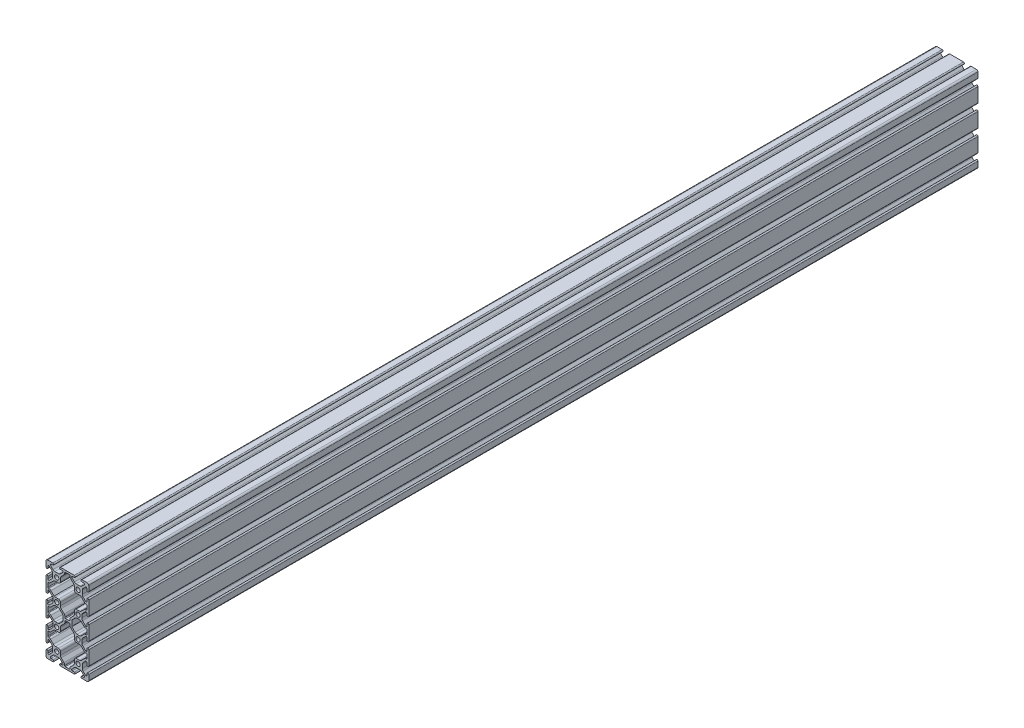
from build123d import *

# Parameters (mm, degrees)
SKETCH1_R      = 2.5
EXTRUDE1_DEPTH = 1039.898


with BuildPart() as part:
    # Sketch1 → Extrude1 (new body)
    with BuildSketch(Plane.XY):
        with BuildLine():
            Line((-8.202452575, 43.310755937), (-5.238252772, 46.27495574))
            ThreePointArc((-5.238252772, 46.27495574), (-5.03697983, 47.286823153), (-5.894799602, 47.86))
            Line((-5.894799602, 47.86), (-8.02436974, 47.86))
            ThreePointArc((-8.02436974, 47.86), (-9.09436974, 48.93), (-8.02436974, 50))
            Line((-8.02436974, 50), (-2.315834377, 50))
            Line((-2.315834377, 50), (2.315834377, 50))
            Line((2.315834377, 50), (8.02436974, 50))
            ThreePointArc((8.02436974, 50), (9.09436974, 48.93), (8.02436974, 47.86))
            Line((8.02436974, 47.86), (5.894799602, 47.86))
            ThreePointArc((5.894799602, 47.86), (5.03697983, 47.286823153), (5.238252772, 46.27495574))
            Line((5.238252772, 46.27495574), (8.202452575, 43.310755937))
            ThreePointArc((8.202452575, 43.310755937), (9.157595011, 42.672550862), (10.284262293, 42.448444577))
            Line((10.284262293, 42.448444577), (14.708234998, 42.448454152))
            ThreePointArc((14.708234998, 42.448454152), (15.83893827, 42.671117491), (16.797547425, 43.310755937))
            Line((16.797547425, 43.310755937), (19.761747228, 46.27495574))
            ThreePointArc((19.761747228, 46.27495574), (19.96302017, 47.286823153), (19.105200398, 47.86))
            Line((19.105200398, 47.86), (16.97563026, 47.86))
            ThreePointArc((16.97563026, 47.86), (15.90563026, 48.93), (16.97563026, 50))
            Line((16.97563026, 50), (21.758832238, 50))
            Line((21.758832238, 50), (23.041124805, 50))
            ThreePointArc((23.041124805, 50), (24.332005248, 49.521885571), (25, 48.318245783))
            Line((25, 48.318245783), (25, 42.082202669))
            ThreePointArc((25, 42.082202669), (23.93, 41.012202669), (22.86, 42.082202669))
            Line((22.86, 42.082202669), (22.86, 44.211772807))
            ThreePointArc((22.86, 44.211772807), (22.13773437, 44.916244594), (21.164272753, 44.651064241))
            Line((21.164272753, 44.651064241), (18.327918757, 41.814710246))
            ThreePointArc((18.327918757, 41.814710246), (17.639489034, 40.784402354), (17.397744663, 39.569071332))
            Line((17.397744663, 39.569071332), (17.397744663, 35.430928668))
            ThreePointArc((17.397744663, 35.430928668), (17.639489034, 34.215597646), (18.327918757, 33.185289754))
            Line((18.327918757, 33.185289754), (21.127116553, 30.386091959))
            ThreePointArc((21.127116553, 30.386091959), (22.233362186, 30.166046021), (22.86, 31.103875784))
            Line((22.86, 31.103875784), (22.86, 33.442202669))
            ThreePointArc((22.86, 33.442202669), (23.93, 34.512202669), (25, 33.442202669))
            Line((25, 33.442202669), (25, 29.299008941))
            Line((25, 29.299008941), (25, 21.219740648))
            Line((25, 21.219740648), (25, 17.040370729))
            ThreePointArc((25, 17.040370729), (23.904333588, 15.955956055), (22.86646371, 17.095809637))
            Line((22.86646371, 17.095809637), (22.86646371, 19.489411218))
            ThreePointArc((22.86646371, 19.489411218), (22.119482528, 20.02126145), (21.24830289, 19.735094378))
            Line((21.24830289, 19.735094378), (17.927013012, 16.4138045))
            ThreePointArc((17.927013012, 16.4138045), (17.222742213, 15.542217138), (16.865021315, 14.480286045))
            Line((16.865021315, 14.480286045), (16.865021315, 11.373754622))
            ThreePointArc((16.865021315, 11.373754622), (17.006264756, 9.974657926), (17.737790465, 8.77370355))
            Line((17.737790465, 8.77370355), (21.060805533, 5.450688482))
            ThreePointArc((21.060805533, 5.450688482), (22.48261952, 5.067456017), (22.865851985, 6.489270005))
            Line((22.865851985, 6.489270005), (22.865851985, 8.266111582))
            ThreePointArc((22.865851985, 8.266111582), (23.927171289, 9.338940293), (25, 8.277620989))
            Line((25, 8.277620989), (25, 3.7699517))
            Line((25, 3.7699517), (25, -3.7699517))
            Line((25, -3.7699517), (25, -8.277620989))
            ThreePointArc((25, -8.277620989), (23.927171289, -9.338940293), (22.865851985, -8.266111582))
            Line((22.865851985, -8.266111582), (22.865851985, -6.489270005))
            ThreePointArc((22.865851985, -6.489270005), (22.48261952, -5.067456017), (21.060805533, -5.450688482))
            Line((21.060805533, -5.450688482), (17.737790465, -8.77370355))
            ThreePointArc((17.737790465, -8.77370355), (17.006264756, -9.974657926), (16.865021315, -11.373754622))
            Line((16.865021315, -11.373754622), (16.865021315, -14.480286045))
            ThreePointArc((16.865021315, -14.480286045), (17.222742213, -15.542217138), (17.927013012, -16.4138045))
            Line((17.927013012, -16.4138045), (21.24830289, -19.735094378))
            ThreePointArc((21.24830289, -19.735094378), (22.119482528, -20.02126145), (22.86646371, -19.489411218))
            Line((22.86646371, -19.489411218), (22.86646371, -17.095809637))
            ThreePointArc((22.86646371, -17.095809637), (23.904333588, -15.955956055), (25, -17.040370729))
            Line((25, -17.040370729), (25, -21.219740648))
            Line((25, -21.219740648), (25, -29.299008941))
            Line((25, -29.299008941), (25, -33.442202669))
            ThreePointArc((25, -33.442202669), (23.93, -34.512202669), (22.86, -33.442202669))
            Line((22.86, -33.442202669), (22.86, -31.103875784))
            ThreePointArc((22.86, -31.103875784), (22.233362186, -30.166046021), (21.127116553, -30.386091959))
            Line((21.127116553, -30.386091959), (18.327918757, -33.185289754))
            ThreePointArc((18.327918757, -33.185289754), (17.639489034, -34.215597646), (17.397744663, -35.430928668))
            Line((17.397744663, -35.430928668), (17.397744663, -39.569071332))
            ThreePointArc((17.397744663, -39.569071332), (17.639489034, -40.784402354), (18.327918757, -41.814710246))
            Line((18.327918757, -41.814710246), (21.164272753, -44.651064241))
            ThreePointArc((21.164272753, -44.651064241), (22.13773437, -44.916244594), (22.86, -44.211772807))
            Line((22.86, -44.211772807), (22.86, -42.082202669))
            ThreePointArc((22.86, -42.082202669), (23.93, -41.012202669), (25, -42.082202669))
            Line((25, -42.082202669), (25, -48.318245783))
            ThreePointArc((25, -48.318245783), (24.332005248, -49.521885571), (23.041124805, -50))
            Line((23.041124805, -50), (21.758832238, -50))
            Line((21.758832238, -50), (16.97563026, -50))
            ThreePointArc((16.97563026, -50), (15.90563026, -48.93), (16.97563026, -47.86))
            Line((16.97563026, -47.86), (19.105200398, -47.86))
            ThreePointArc((19.105200398, -47.86), (19.96302017, -47.286823153), (19.761747228, -46.27495574))
            Line((19.761747228, -46.27495574), (16.797547425, -43.310755937))
            ThreePointArc((16.797547425, -43.310755937), (15.83893827, -42.671117491), (14.708234998, -42.448454152))
            Line((14.708234998, -42.448454152), (10.284262293, -42.448444577))
            ThreePointArc((10.284262293, -42.448444577), (9.157595011, -42.672550862), (8.202452575, -43.310755937))
            Line((8.202452575, -43.310755937), (5.238252772, -46.27495574))
            ThreePointArc((5.238252772, -46.27495574), (5.03697983, -47.286823153), (5.894799602, -47.86))
            Line((5.894799602, -47.86), (8.02436974, -47.86))
            ThreePointArc((8.02436974, -47.86), (9.09436974, -48.93), (8.02436974, -50))
            Line((8.02436974, -50), (2.315834377, -50))
            Line((2.315834377, -50), (-2.315834377, -50))
            Line((-2.315834377, -50), (-8.02436974, -50))
            ThreePointArc((-8.02436974, -50), (-9.09436974, -48.93), (-8.02436974, -47.86))
            Line((-8.02436974, -47.86), (-5.894799602, -47.86))
            ThreePointArc((-5.894799602, -47.86), (-5.03697983, -47.286823153), (-5.238252772, -46.27495574))
            Line((-5.238252772, -46.27495574), (-8.202452575, -43.310755937))
            ThreePointArc((-8.202452575, -43.310755937), (-9.157595011, -42.672550862), (-10.284262293, -42.448444577))
            Line((-10.284262293, -42.448444577), (-14.708234998, -42.448454152))
            ThreePointArc((-14.708234998, -42.448454152), (-15.83893827, -42.671117491), (-16.797547425, -43.310755937))
            Line((-16.797547425, -43.310755937), (-19.761747228, -46.27495574))
            ThreePointArc((-19.761747228, -46.27495574), (-19.96302017, -47.286823153), (-19.105200398, -47.86))
            Line((-19.105200398, -47.86), (-16.97563026, -47.86))
            ThreePointArc((-16.97563026, -47.86), (-15.90563026, -48.93), (-16.97563026, -50))
            Line((-16.97563026, -50), (-23.041124805, -50))
            ThreePointArc((-23.041124805, -50), (-24.332005248, -49.521885571), (-25, -48.318245783))
            Line((-25, -48.318245783), (-25, -42.082202669))
            ThreePointArc((-25, -42.082202669), (-23.93, -41.012202669), (-22.86, -42.082202669))
            Line((-22.86, -42.082202669), (-22.86, -44.211772807))
            ThreePointArc((-22.86, -44.211772807), (-22.13773437, -44.916244594), (-21.164272753, -44.651064241))
            Line((-21.164272753, -44.651064241), (-18.327918757, -41.814710246))
            ThreePointArc((-18.327918757, -41.814710246), (-17.639489034, -40.784402354), (-17.397744663, -39.569071332))
            Line((-17.397744663, -39.569071332), (-17.397744663, -35.430928668))
            ThreePointArc((-17.397744663, -35.430928668), (-17.639489034, -34.215597646), (-18.327918757, -33.185289754))
            Line((-18.327918757, -33.185289754), (-21.127116553, -30.386091959))
            ThreePointArc((-21.127116553, -30.386091959), (-22.233362186, -30.166046021), (-22.86, -31.103875784))
            Line((-22.86, -31.103875784), (-22.86, -33.442202669))
            ThreePointArc((-22.86, -33.442202669), (-23.93, -34.512202669), (-25, -33.442202669))
            Line((-25, -33.442202669), (-25, -29.299008941))
            Line((-25, -29.299008941), (-25, -21.219740648))
            Line((-25, -21.219740648), (-25, -17.040370729))
            ThreePointArc((-25, -17.040370729), (-23.904333588, -15.955956055), (-22.86646371, -17.095809637))
            Line((-22.86646371, -17.095809637), (-22.86646371, -19.489411218))
            ThreePointArc((-22.86646371, -19.489411218), (-22.119482528, -20.02126145), (-21.24830289, -19.735094378))
            Line((-21.24830289, -19.735094378), (-17.927013012, -16.4138045))
            ThreePointArc((-17.927013012, -16.4138045), (-17.222742213, -15.542217138), (-16.865021315, -14.480286045))
            Line((-16.865021315, -14.480286045), (-16.865021315, -11.373754622))
            ThreePointArc((-16.865021315, -11.373754622), (-17.006264756, -9.974657926), (-17.737790465, -8.77370355))
            Line((-17.737790465, -8.77370355), (-21.060805533, -5.450688482))
            ThreePointArc((-21.060805533, -5.450688482), (-22.48261952, -5.067456017), (-22.865851985, -6.489270005))
            Line((-22.865851985, -6.489270005), (-22.865851985, -8.266111582))
            ThreePointArc((-22.865851985, -8.266111582), (-23.927171289, -9.338940293), (-25, -8.277620989))
            Line((-25, -8.277620989), (-25, -3.7699517))
            Line((-25, -3.7699517), (-25, 3.7699517))
            Line((-25, 3.7699517), (-25, 8.277620989))
            ThreePointArc((-25, 8.277620989), (-23.927171289, 9.338940293), (-22.865851985, 8.266111582))
            Line((-22.865851985, 8.266111582), (-22.865851985, 6.489270005))
            ThreePointArc((-22.865851985, 6.489270005), (-22.48261952, 5.067456017), (-21.060805533, 5.450688482))
            Line((-21.060805533, 5.450688482), (-17.737790465, 8.77370355))
            ThreePointArc((-17.737790465, 8.77370355), (-17.006264756, 9.974657926), (-16.865021315, 11.373754622))
            Line((-16.865021315, 11.373754622), (-16.865021315, 14.480286045))
            ThreePointArc((-16.865021315, 14.480286045), (-17.222742213, 15.542217138), (-17.927013012, 16.4138045))
            Line((-17.927013012, 16.4138045), (-21.24830289, 19.735094378))
            ThreePointArc((-21.24830289, 19.735094378), (-22.119482528, 20.02126145), (-22.86646371, 19.489411218))
            Line((-22.86646371, 19.489411218), (-22.86646371, 17.095809637))
            ThreePointArc((-22.86646371, 17.095809637), (-23.904333588, 15.955956055), (-25, 17.040370729))
            Line((-25, 17.040370729), (-25, 21.219740648))
            Line((-25, 21.219740648), (-25, 29.299008941))
            Line((-25, 29.299008941), (-25, 33.442202669))
            ThreePointArc((-25, 33.442202669), (-23.93, 34.512202669), (-22.86, 33.442202669))
            Line((-22.86, 33.442202669), (-22.86, 31.103875784))
            ThreePointArc((-22.86, 31.103875784), (-22.233362186, 30.166046021), (-21.127116553, 30.386091959))
            Line((-21.127116553, 30.386091959), (-18.327918757, 33.185289754))
            ThreePointArc((-18.327918757, 33.185289754), (-17.639489034, 34.215597646), (-17.397744663, 35.430928668))
            Line((-17.397744663, 35.430928668), (-17.397744663, 39.569071332))
            ThreePointArc((-17.397744663, 39.569071332), (-17.639489034, 40.784402354), (-18.327918757, 41.814710246))
            Line((-18.327918757, 41.814710246), (-21.164272753, 44.651064241))
            ThreePointArc((-21.164272753, 44.651064241), (-22.13773437, 44.916244594), (-22.86, 44.211772807))
            Line((-22.86, 44.211772807), (-22.86, 42.082202669))
            ThreePointArc((-22.86, 42.082202669), (-23.93, 41.012202669), (-25, 42.082202669))
            Line((-25, 42.082202669), (-25, 48.318245783))
            ThreePointArc((-25, 48.318245783), (-24.332005248, 49.521885571), (-23.041124805, 50))
            Line((-23.041124805, 50), (-16.97563026, 50))
            ThreePointArc((-16.97563026, 50), (-15.90563026, 48.93), (-16.97563026, 47.86))
            Line((-16.97563026, 47.86), (-19.105200398, 47.86))
            ThreePointArc((-19.105200398, 47.86), (-19.96302017, 47.286823153), (-19.761747228, 46.27495574))
            Line((-19.761747228, 46.27495574), (-16.797547425, 43.310755937))
            ThreePointArc((-16.797547425, 43.310755937), (-15.83893827, 42.671117491), (-14.708234998, 42.448454152))
            Line((-14.708234998, 42.448454152), (-10.284262293, 42.448444577))
            ThreePointArc((-10.284262293, 42.448444577), (-9.157595011, 42.672550862), (-8.202452575, 43.310755937))
        make_face()
        with Locations((-12.5, 12.5)):
            Circle(SKETCH1_R, mode=Mode.SUBTRACT)
        with Locations((-12.5, 37.5)):
            Circle(SKETCH1_R, mode=Mode.SUBTRACT)
        with Locations((12.5, -12.5)):
            Circle(SKETCH1_R, mode=Mode.SUBTRACT)
        with Locations((12.5, -37.5)):
            Circle(SKETCH1_R, mode=Mode.SUBTRACT)
        with Locations(Location((-12.5, -37.5, 0), (0, 0, 180))):
            Circle(SKETCH1_R, mode=Mode.SUBTRACT)
        with Locations(Location((-12.5, -12.5, 0), (0, 0, 180))):
            Circle(SKETCH1_R, mode=Mode.SUBTRACT)
        with Locations(Location((12.5, 37.5, 0), (0, 0, 180))):
            Circle(SKETCH1_R, mode=Mode.SUBTRACT)
        with Locations(Location((12.5, 12.5, 0), (0, 0, 180))):
            Circle(SKETCH1_R, mode=Mode.SUBTRACT)
        with BuildLine():
            Line((-8.185773444, 12.487513796), (-8.185773444, 11.011393555))
            ThreePointArc((-8.185773444, 11.011393555), (-8.008609194, 9.643792267), (-7.268461542, 8.480219361))
            Line((-7.268461542, 8.480219361), (-3.754938975, 4.966696794))
            ThreePointArc((-3.754938975, 4.966696794), (-3.063534403, 3.923946022), (-2.832523582, 2.694310526))
            Line((-2.832523582, 2.694310526), (-2.832523582, 1.819708918))
            ThreePointArc((-2.832523582, 1.819708918), (-2.609281799, 1.280755579), (-2.07032846, 1.057513796))
            Line((-2.07032846, 1.057513796), (2.072320044, 1.057513796))
            ThreePointArc((2.072320044, 1.057513796), (2.611273383, 1.280755579), (2.834515166, 1.819708918))
            Line((2.834515166, 1.819708918), (2.834515166, 2.694310526))
            ThreePointArc((2.834515166, 2.694310526), (3.065525987, 3.923946022), (3.756930558, 4.966696794))
            Line((3.756930558, 4.966696794), (7.270453125, 8.480219361))
            ThreePointArc((7.270453125, 8.480219361), (8.010600778, 9.643792267), (8.187765028, 11.011393555))
            Line((8.187765028, 11.011393555), (8.187765028, 14.589100627))
            ThreePointArc((8.187765028, 14.589100627), (8.835059042, 16.151806613), (10.397765028, 16.799100627))
            Line((10.397765028, 16.799100627), (14.322526745, 16.799100627))
            ThreePointArc((14.322526745, 16.799100627), (14.978333775, 16.883638222), (15.602419985, 17.102146501))
            Line((15.602419985, 17.102146501), (19.298207918, 20.797934434))
            ThreePointArc((19.298207918, 20.797934434), (20.326629934, 21.485104056), (21.539736414, 21.726405938))
            Line((21.539736414, 21.726405938), (22.112655364, 21.726405938))
            ThreePointArc((22.112655364, 21.726405938), (22.651608703, 21.94964772), (22.874850486, 22.488601059))
            Line((22.874850486, 22.488601059), (22.874850486, 26.856767325))
            ThreePointArc((22.874850486, 26.856767325), (22.653840578, 27.386829201), (22.125606626, 27.612173081))
            Line((22.125606626, 27.612173081), (21.871541586, 27.612173081))
            ThreePointArc((21.871541586, 27.612173081), (20.717547023, 27.958593442), (19.776177785, 28.710613704))
            Line((19.776177785, 28.710613704), (16.387363346, 32.099428142))
            ThreePointArc((16.387363346, 32.099428142), (15.195987364, 32.790442646), (13.839798728, 33.030505467))
            Line((13.839798728, 33.030505467), (10.362350257, 33.030505467))
            ThreePointArc((10.362350257, 33.030505467), (8.799644271, 33.67779948), (8.152350257, 35.240505467))
            Line((8.152350257, 35.240505467), (8.152350257, 39.051208905))
            ThreePointArc((8.152350257, 39.051208905), (7.904533851, 40.249092372), (7.222341418, 41.26445007))
            Line((7.222341418, 41.26445007), (4.012209831, 44.474581658))
            ThreePointArc((4.012209831, 44.474581658), (3.329287545, 45.496647086), (3.089477129, 46.70225546))
            Line((3.089477129, 46.70225546), (3.089477129, 47.097840517))
            ThreePointArc((3.089477129, 47.097840517), (2.866245785, 47.636768656), (2.327317646, 47.86))
            Line((2.327317646, 47.86), (0, 47.86))
            Line((0, 47.86), (-2.327317646, 47.86))
            ThreePointArc((-2.327317646, 47.86), (-2.866245785, 47.636768656), (-3.089477129, 47.097840517))
            Line((-3.089477129, 47.097840517), (-3.089477129, 46.70225546))
            ThreePointArc((-3.089477129, 46.70225546), (-3.329287545, 45.496647086), (-4.012209831, 44.474581658))
            Line((-4.012209831, 44.474581658), (-7.222341418, 41.26445007))
            ThreePointArc((-7.222341418, 41.26445007), (-7.904533851, 40.249092372), (-8.152350257, 39.051208905))
            Line((-8.152350257, 39.051208905), (-8.152350257, 35.240505467))
            ThreePointArc((-8.152350257, 35.240505467), (-8.799644271, 33.67779948), (-10.362350257, 33.030505467))
            Line((-10.362350257, 33.030505467), (-10.389864765, 33.030505467))
            Line((-10.389864765, 33.030505467), (-13.839798728, 33.030505467))
            ThreePointArc((-13.839798728, 33.030505467), (-15.195987364, 32.790442646), (-16.387363346, 32.099428142))
            Line((-16.387363346, 32.099428142), (-19.776177785, 28.710613704))
            ThreePointArc((-19.776177785, 28.710613704), (-20.711520847, 27.964936369), (-21.856598739, 27.618962447))
            Line((-21.856598739, 27.618962447), (-22.11066378, 27.618962447))
            ThreePointArc((-22.11066378, 27.618962447), (-22.649617119, 27.395720665), (-22.872858902, 26.856767325))
            Line((-22.872858902, 26.856767325), (-22.872858902, 22.488601059))
            ThreePointArc((-22.872858902, 22.488601059), (-22.649617119, 21.94964772), (-22.11066378, 21.726405938))
            Line((-22.11066378, 21.726405938), (-21.537744831, 21.726405938))
            ThreePointArc((-21.537744831, 21.726405938), (-20.32463835, 21.485104056), (-19.296216334, 20.797934434))
            Line((-19.296216334, 20.797934434), (-15.600428402, 17.102146501))
            ThreePointArc((-15.600428402, 17.102146501), (-14.976342192, 16.883638222), (-14.320535162, 16.799100627))
            Line((-14.320535162, 16.799100627), (-10.395773444, 16.799100627))
            ThreePointArc((-10.395773444, 16.799100627), (-8.833067458, 16.151806613), (-8.185773444, 14.589100627))
            Line((-8.185773444, 14.589100627), (-8.185773444, 12.487513796))
        make_face(mode=Mode.SUBTRACT)
        with BuildLine():
            Line((-22.86, 2.484036233), (-22.86, -2.484036233))
            ThreePointArc((-22.86, -2.484036233), (-22.636758217, -3.022989573), (-22.097804878, -3.246231355))
            Line((-22.097804878, -3.246231355), (-21.843739837, -3.246231355))
            ThreePointArc((-21.843739837, -3.246231355), (-20.485171192, -3.421032102), (-19.329200619, -4.155876372))
            Line((-19.329200619, -4.155876372), (-16.293050967, -7.192026025))
            ThreePointArc((-16.293050967, -7.192026025), (-15.262743076, -7.880455748), (-14.047412053, -8.122200119))
            Line((-14.047412053, -8.122200119), (-11.24083373, -8.122200119))
            ThreePointArc((-11.24083373, -8.122200119), (-10.025502708, -7.880455748), (-8.995194816, -7.192026025))
            Line((-8.995194816, -7.192026025), (-5.327964206, -3.524795414))
            ThreePointArc((-5.327964206, -3.524795414), (-5.186657366, -3.313314782), (-5.137037002, -3.063856368))
            Line((-5.137037002, -3.063856368), (-5.137037002, 3.063856368))
            ThreePointArc((-5.137037002, 3.063856368), (-5.186657366, 3.313314782), (-5.327964206, 3.524795414))
            Line((-5.327964206, 3.524795414), (-8.995194816, 7.192026025))
            ThreePointArc((-8.995194816, 7.192026025), (-10.025502708, 7.880455748), (-11.24083373, 8.122200119))
            Line((-11.24083373, 8.122200119), (-14.047412053, 8.122200119))
            ThreePointArc((-14.047412053, 8.122200119), (-15.262743076, 7.880455748), (-16.293050967, 7.192026025))
            Line((-16.293050967, 7.192026025), (-19.329200619, 4.155876372))
            ThreePointArc((-19.329200619, 4.155876372), (-20.485171192, 3.421032102), (-21.843739837, 3.246231355))
            Line((-21.843739837, 3.246231355), (-22.097804878, 3.246231355))
            ThreePointArc((-22.097804878, 3.246231355), (-22.636758217, 3.022989573), (-22.86, 2.484036233))
        make_face(mode=Mode.SUBTRACT)
        with BuildLine():
            Line((5.137037002, 3.063856368), (5.137037002, -3.063856368))
            ThreePointArc((5.137037002, -3.063856368), (5.186657366, -3.313314782), (5.327964206, -3.524795414))
            Line((5.327964206, -3.524795414), (8.995194816, -7.192026025))
            ThreePointArc((8.995194816, -7.192026025), (10.025502708, -7.880455748), (11.24083373, -8.122200119))
            Line((11.24083373, -8.122200119), (14.047412053, -8.122200119))
            ThreePointArc((14.047412053, -8.122200119), (15.262743076, -7.880455748), (16.293050967, -7.192026025))
            Line((16.293050967, -7.192026025), (19.329200619, -4.155876372))
            ThreePointArc((19.329200619, -4.155876372), (20.485171192, -3.421032102), (21.843739837, -3.246231355))
            Line((21.843739837, -3.246231355), (22.097804878, -3.246231355))
            ThreePointArc((22.097804878, -3.246231355), (22.636758217, -3.022989573), (22.86, -2.484036233))
            Line((22.86, -2.484036233), (22.86, 2.484036233))
            ThreePointArc((22.86, 2.484036233), (22.636758217, 3.022989573), (22.097804878, 3.246231355))
            Line((22.097804878, 3.246231355), (21.843739837, 3.246231355))
            ThreePointArc((21.843739837, 3.246231355), (20.485171192, 3.421032102), (19.329200619, 4.155876372))
            Line((19.329200619, 4.155876372), (16.293050967, 7.192026025))
            ThreePointArc((16.293050967, 7.192026025), (15.262743076, 7.880455748), (14.047412053, 8.122200119))
            Line((14.047412053, 8.122200119), (11.24083373, 8.122200119))
            ThreePointArc((11.24083373, 8.122200119), (10.025502708, 7.880455748), (8.995194816, 7.192026025))
            Line((8.995194816, 7.192026025), (5.327964206, 3.524795414))
            ThreePointArc((5.327964206, 3.524795414), (5.186657366, 3.313314782), (5.137037002, 3.063856368))
        make_face(mode=Mode.SUBTRACT)
        with BuildLine():
            Line((-2.832523582, -2.694310526), (-2.832523582, -1.819708918))
            ThreePointArc((-2.832523582, -1.819708918), (-2.609281799, -1.280755579), (-2.07032846, -1.057513796))
            Line((-2.07032846, -1.057513796), (2.072320044, -1.057513796))
            ThreePointArc((2.072320044, -1.057513796), (2.611273383, -1.280755579), (2.834515166, -1.819708918))
            Line((2.834515166, -1.819708918), (2.834515166, -2.694310526))
            ThreePointArc((2.834515166, -2.694310526), (3.065525987, -3.923946022), (3.756930558, -4.966696794))
            Line((3.756930558, -4.966696794), (7.270453125, -8.480219361))
            ThreePointArc((7.270453125, -8.480219361), (8.010600778, -9.643792267), (8.187765028, -11.011393555))
            Line((8.187765028, -11.011393555), (8.187765028, -14.589100627))
            ThreePointArc((8.187765028, -14.589100627), (8.835059042, -16.151806613), (10.397765028, -16.799100627))
            Line((10.397765028, -16.799100627), (14.322526745, -16.799100627))
            ThreePointArc((14.322526745, -16.799100627), (14.978333775, -16.883638222), (15.602419985, -17.102146501))
            Line((15.602419985, -17.102146501), (19.298207918, -20.797934434))
            ThreePointArc((19.298207918, -20.797934434), (20.326629934, -21.485104056), (21.539736414, -21.726405938))
            Line((21.539736414, -21.726405938), (22.112655364, -21.726405938))
            ThreePointArc((22.112655364, -21.726405938), (22.651608703, -21.94964772), (22.874850486, -22.488601059))
            Line((22.874850486, -22.488601059), (22.874850486, -26.856767325))
            ThreePointArc((22.874850486, -26.856767325), (22.653840578, -27.386829201), (22.125606626, -27.612173081))
            Line((22.125606626, -27.612173081), (21.871541586, -27.612173081))
            ThreePointArc((21.871541586, -27.612173081), (20.717547023, -27.958593442), (19.776177785, -28.710613704))
            Line((19.776177785, -28.710613704), (16.387363346, -32.099428142))
            ThreePointArc((16.387363346, -32.099428142), (15.195987364, -32.790442646), (13.839798728, -33.030505467))
            Line((13.839798728, -33.030505467), (10.362350257, -33.030505467))
            ThreePointArc((10.362350257, -33.030505467), (8.799644271, -33.67779948), (8.152350257, -35.240505467))
            Line((8.152350257, -35.240505467), (8.152350257, -39.051208905))
            ThreePointArc((8.152350257, -39.051208905), (7.904533851, -40.249092372), (7.222341418, -41.26445007))
            Line((7.222341418, -41.26445007), (4.012209831, -44.474581658))
            ThreePointArc((4.012209831, -44.474581658), (3.329287545, -45.496647086), (3.089477129, -46.70225546))
            Line((3.089477129, -46.70225546), (3.089477129, -47.097840517))
            ThreePointArc((3.089477129, -47.097840517), (2.866245785, -47.636768656), (2.327317646, -47.86))
            Line((2.327317646, -47.86), (0, -47.86))
            Line((0, -47.86), (-2.327317646, -47.86))
            ThreePointArc((-2.327317646, -47.86), (-2.866245785, -47.636768656), (-3.089477129, -47.097840517))
            Line((-3.089477129, -47.097840517), (-3.089477129, -46.70225546))
            ThreePointArc((-3.089477129, -46.70225546), (-3.329287545, -45.496647086), (-4.012209831, -44.474581658))
            Line((-4.012209831, -44.474581658), (-7.222341418, -41.26445007))
            ThreePointArc((-7.222341418, -41.26445007), (-7.904533851, -40.249092372), (-8.152350257, -39.051208905))
            Line((-8.152350257, -39.051208905), (-8.152350257, -35.240505467))
            ThreePointArc((-8.152350257, -35.240505467), (-8.799644271, -33.67779948), (-10.362350257, -33.030505467))
            Line((-10.362350257, -33.030505467), (-10.389864765, -33.030505467))
            Line((-10.389864765, -33.030505467), (-13.839798728, -33.030505467))
            ThreePointArc((-13.839798728, -33.030505467), (-15.195987364, -32.790442646), (-16.387363346, -32.099428142))
            Line((-16.387363346, -32.099428142), (-19.776177785, -28.710613704))
            ThreePointArc((-19.776177785, -28.710613704), (-20.711520847, -27.964936369), (-21.856598739, -27.618962447))
            Line((-21.856598739, -27.618962447), (-22.11066378, -27.618962447))
            ThreePointArc((-22.11066378, -27.618962447), (-22.649617119, -27.395720665), (-22.872858902, -26.856767325))
            Line((-22.872858902, -26.856767325), (-22.872858902, -22.488601059))
            ThreePointArc((-22.872858902, -22.488601059), (-22.649617119, -21.94964772), (-22.11066378, -21.726405938))
            Line((-22.11066378, -21.726405938), (-21.537744831, -21.726405938))
            ThreePointArc((-21.537744831, -21.726405938), (-20.32463835, -21.485104056), (-19.296216334, -20.797934434))
            Line((-19.296216334, -20.797934434), (-15.600428402, -17.102146501))
            ThreePointArc((-15.600428402, -17.102146501), (-14.976342192, -16.883638222), (-14.320535162, -16.799100627))
            Line((-14.320535162, -16.799100627), (-10.395773444, -16.799100627))
            ThreePointArc((-10.395773444, -16.799100627), (-8.833067458, -16.151806613), (-8.185773444, -14.589100627))
            Line((-8.185773444, -14.589100627), (-8.185773444, -12.487513796))
            Line((-8.185773444, -12.487513796), (-8.185773444, -11.011393555))
            ThreePointArc((-8.185773444, -11.011393555), (-8.008609194, -9.643792267), (-7.268461542, -8.480219361))
            Line((-7.268461542, -8.480219361), (-3.754938975, -4.966696794))
            ThreePointArc((-3.754938975, -4.966696794), (-3.063534403, -3.923946022), (-2.832523582, -2.694310526))
        make_face(mode=Mode.SUBTRACT)
    extrude(amount=-EXTRUDE1_DEPTH)


solid = part.part
